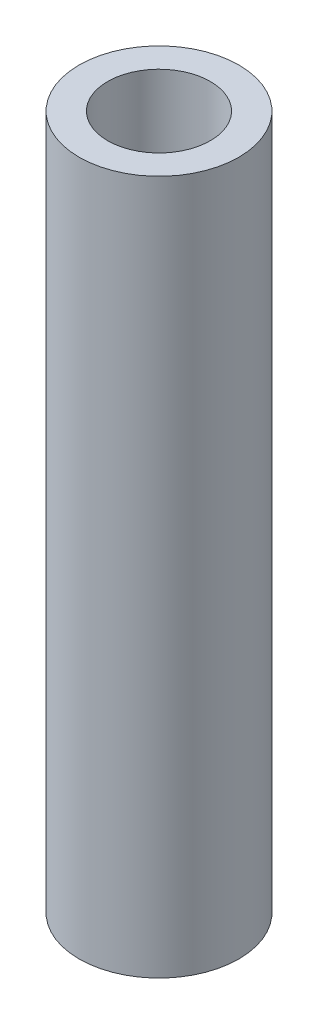
from build123d import *

# Parameters (mm, degrees)
SKETCH1_R           = 3.873
SKETCH1_R_2         = 2.4892
BOSS_EXTRUDE1_DEPTH = 33.669986


with BuildPart() as part:
    # Sketch1 → Boss-Extrude1 (new body)
    with BuildSketch(Plane(origin=(0, 0, 0), x_dir=(1, 0, 0), z_dir=(0, 1, 0))):
        with Locations(Location((0, 0, 0), (0, 0, 270))):
            Circle(SKETCH1_R)
        with Locations(Location((0, 0, 0), (0, 0, 270))):
            Circle(SKETCH1_R_2, mode=Mode.SUBTRACT)
    extrude(amount=BOSS_EXTRUDE1_DEPTH)


solid = part.part
